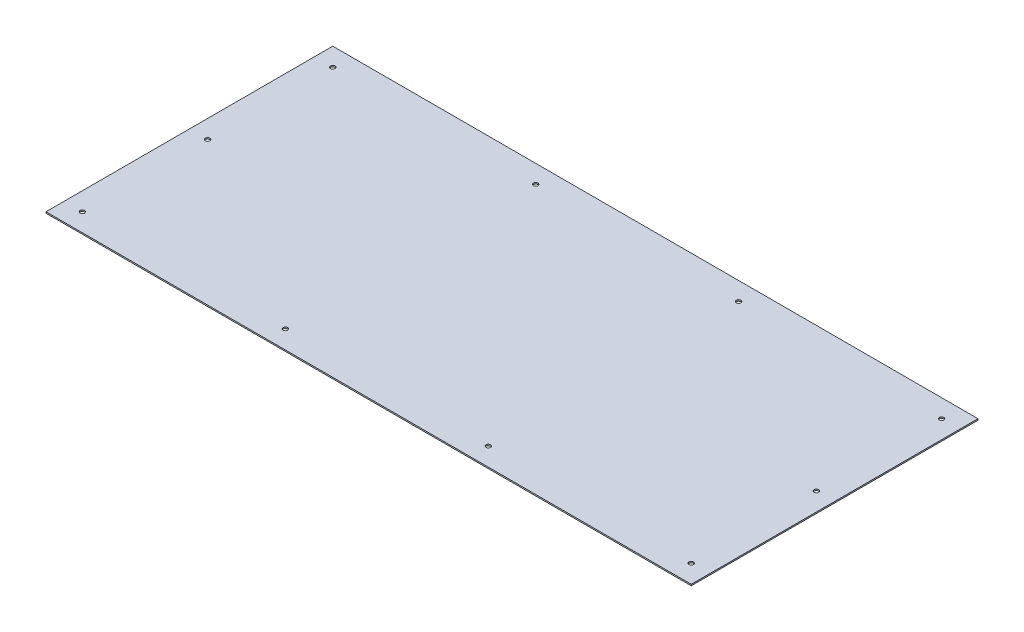
from build123d import *

# Parameters (mm, degrees)
CROQUIS1_W              = 900
CROQUIS1_H              = 400
SALIENTE_EXTRUIR1_DEPTH = 1.9
CROQUIS3_R              = 3.175
CORTAR_EXTRUIR1_DEPTH   = 10


with BuildPart() as part:
    # Croquis1 → Saliente-Extruir1 (new body)
    with BuildSketch(Plane(origin=(0, 0, 0), x_dir=(1, 0, 0), z_dir=(0, 1, 0))):
        Rectangle(CROQUIS1_W, CROQUIS1_H)
    extrude(amount=SALIENTE_EXTRUIR1_DEPTH)

    # Croquis3 → Cortar-Extruir1 (cut)
    with BuildSketch(Plane(origin=(0, 1.9, 0), x_dir=(1, 0, 0), z_dir=(0, 1, 0))):
        with Locations(Location((-424.6, -174.6, 0), (0, 0, 270))):
            Circle(CROQUIS3_R)
        with Locations(Location((-424.6, 174.6, 0), (0, 0, 270))):
            Circle(CROQUIS3_R)
        with Locations(Location((-424.6, 0, 0), (0, 0, 270))):
            Circle(CROQUIS3_R)
        with Locations(Location((424.6, 174.6, 0), (0, 0, 270))):
            Circle(CROQUIS3_R)
        with Locations(Location((424.6, 0, 0), (0, 0, 270))):
            Circle(CROQUIS3_R)
        with Locations(Location((424.6, -174.6, 0), (0, 0, 270))):
            Circle(CROQUIS3_R)
        with Locations(Location((-141.54, -174.6, 0), (0, 0, 270))):
            Circle(CROQUIS3_R)
        with Locations(Location((141.52, -174.6, 0), (0, 0, 270))):
            Circle(CROQUIS3_R)
        with Locations(Location((141.52, 174.6, 0), (0, 0, 270))):
            Circle(CROQUIS3_R)
        with Locations(Location((-141.54, 174.6, 0), (0, 0, 270))):
            Circle(CROQUIS3_R)
    extrude(amount=-CORTAR_EXTRUIR1_DEPTH, mode=Mode.SUBTRACT)


solid = part.part
